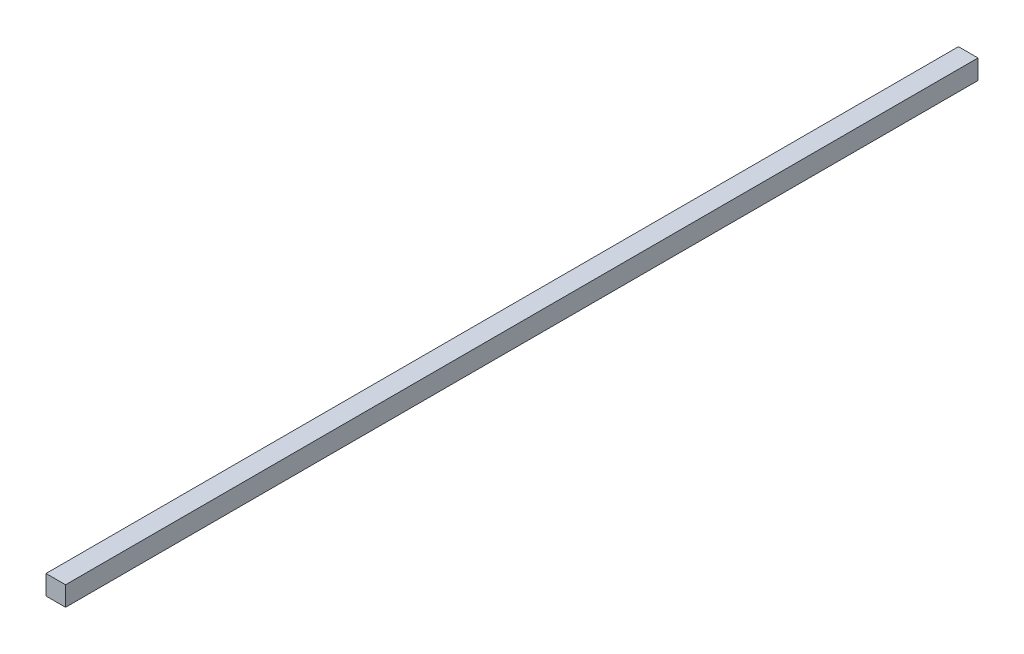
from build123d import *

# Parameters (mm, degrees)
SKETCH_1_W      = 30
SKETCH_1_H      = 30
EXTRUDE_1_DEPTH = 1400


with BuildPart() as part:
    # 草图1 → 凸台-拉伸1 (new body)
    with BuildSketch(Plane.XY):
        Rectangle(SKETCH_1_W, SKETCH_1_H)
    extrude(amount=EXTRUDE_1_DEPTH)


solid = part.part
